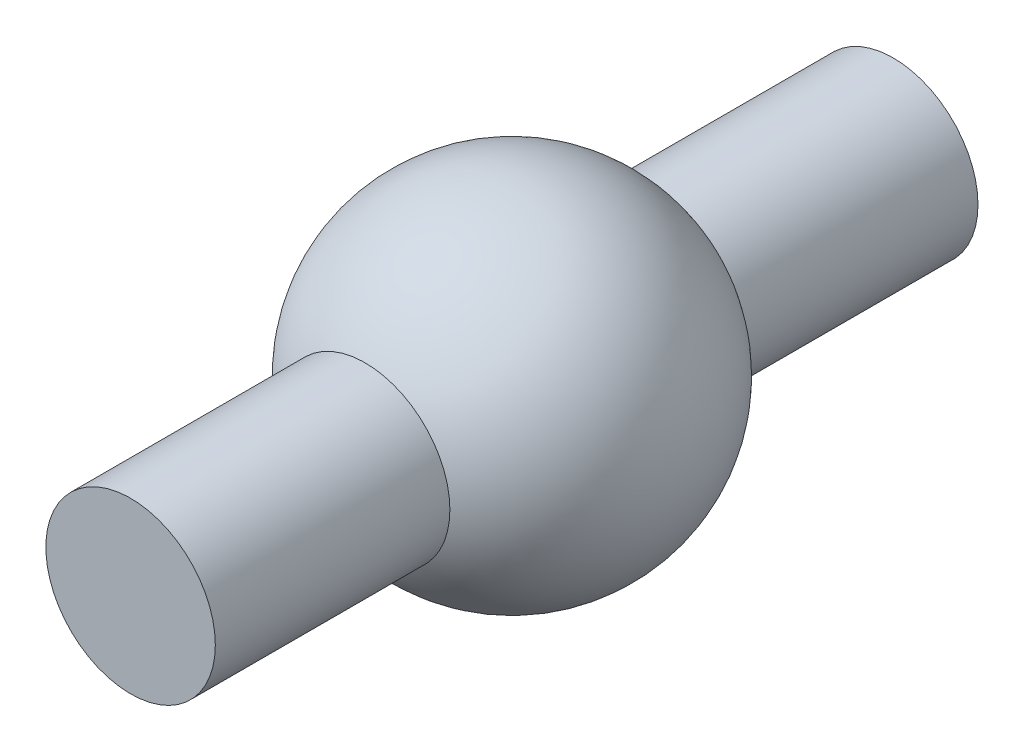
from build123d import *

# Parameters (mm, degrees)
SKETCH2_R           = 1.27
BOSS_EXTRUDE1_DEPTH = 5.715


with BuildPart() as part:
    # Sketch1 → Revolve1 (revolve)
    with BuildSketch(Plane(origin=(0, 0, 0), x_dir=(1, 0, 0), z_dir=(0, 1, 0))):
        with BuildLine():
            Line((0, 2.54), (0, -2.54))
            ThreePointArc((0, -2.54), (2.54, 0), (0, 2.54))
        make_face()
    revolve(axis=Axis((0, 0, -2.54), (0, 0, 1)))

    # Sketch2 → Boss-Extrude1 (add, symmetric)
    with BuildSketch(Plane.XY):
        Circle(SKETCH2_R)
    extrude(amount=BOSS_EXTRUDE1_DEPTH, both=True)


solid = part.part
